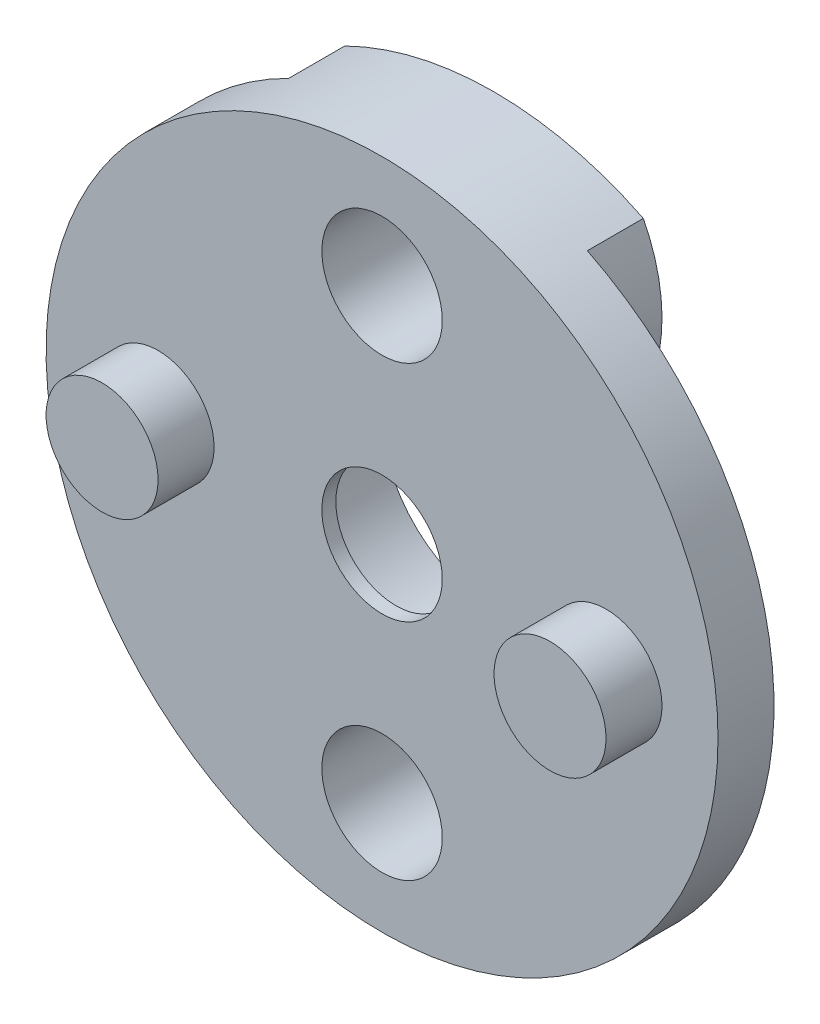
from build123d import *
from build123d.topology import SkipClean

# Parameters (mm, degrees)
SKETCH1_R                  = 12
BOSS_EXTRUDE1_DEPTH        = 2
SKETCH2_R                  = 2
BOSS_EXTRUDE2_DEPTH        = 2
F_4_3_4_3_DIAMETER_HOLE1_D = 4.3
BOSS_EXTRUDE3_START        = 2
SKETCH5_R                  = 2.15
SKETCH5_R_2                = 4
BOSS_EXTRUDE3_DEPTH        = 2
SKETCH6_R                  = 4
CUT_EXTRUDE1_DEPTH         = 1.5


with BuildPart() as part:
    # Sketch1 → Boss-Extrude1 (new body)
    with BuildSketch(Plane.XY):
        Circle(SKETCH1_R)
    extrude(amount=BOSS_EXTRUDE1_DEPTH)

    # Sketch2 → Boss-Extrude2 (add)
    with BuildSketch(Plane.XY.offset(2)):
        with Locations((-8, 0)):
            Circle(SKETCH2_R)
        with Locations((8, 0)):
            Circle(SKETCH2_R)
    extrude(amount=BOSS_EXTRUDE2_DEPTH)

    # Ø4.3 (4.3) Diameter Hole1 (through all)
    with Locations(Plane.XY.offset(2)):
        with Locations((0, 8), (0, 0), (0, -8)):
            Hole(F_4_3_4_3_DIAMETER_HOLE1_D / 2)

    # Sketch5 → Boss-Extrude3 (add)
    with SkipClean():  # the faces are left unmerged after this step: merging them gives an invalid solid
        with BuildSketch(Plane(origin=(0, 0, 0), x_dir=(-1, 0, 0), z_dir=(0, 0, -1)).offset(BOSS_EXTRUDE3_START)):
            with BuildLine():
                ThreePointArc((4.472135955, -4), (6, 0), (4.472135955, 4))
                ThreePointArc((4.472135955, 4), (5.951826612, 7.241211504), (5.332682252, 10.75))
                ThreePointArc((5.332682252, 10.75), (0, 12), (-5.332682252, 10.75))
                ThreePointArc((-5.332682252, 10.75), (-5.951826612, 7.241211504), (-4.472135955, 4))
                ThreePointArc((-4.472135955, 4), (-6, 0), (-4.472135955, -4))
                ThreePointArc((-4.472135955, -4), (-5.951826612, -7.241211504), (-5.332682252, -10.75))
                ThreePointArc((-5.332682252, -10.75), (0, -12), (5.332682252, -10.75))
                ThreePointArc((5.332682252, -10.75), (5.951826612, -7.241211504), (4.472135955, -4))
            make_face()
            with Locations(Location((0, 8, 0), (0, 0, 180))):
                Circle(SKETCH5_R, mode=Mode.SUBTRACT)
            with Locations(Location((0, -8, 0), (0, 0, 180))):
                Circle(SKETCH5_R, mode=Mode.SUBTRACT)
            Circle(SKETCH5_R_2, mode=Mode.SUBTRACT)
        extrude(amount=-BOSS_EXTRUDE3_DEPTH)

    # Sketch6 → Cut-Extrude1 (cut)
    with SkipClean():  # the faces are left unmerged after this step: merging them gives an invalid solid
        with BuildSketch(Plane(origin=(0, 0, 0), x_dir=(-1, 0, 0), z_dir=(0, 0, -1))):
            Circle(SKETCH6_R)
        extrude(amount=-CUT_EXTRUDE1_DEPTH, mode=Mode.SUBTRACT)


solid = part.part
